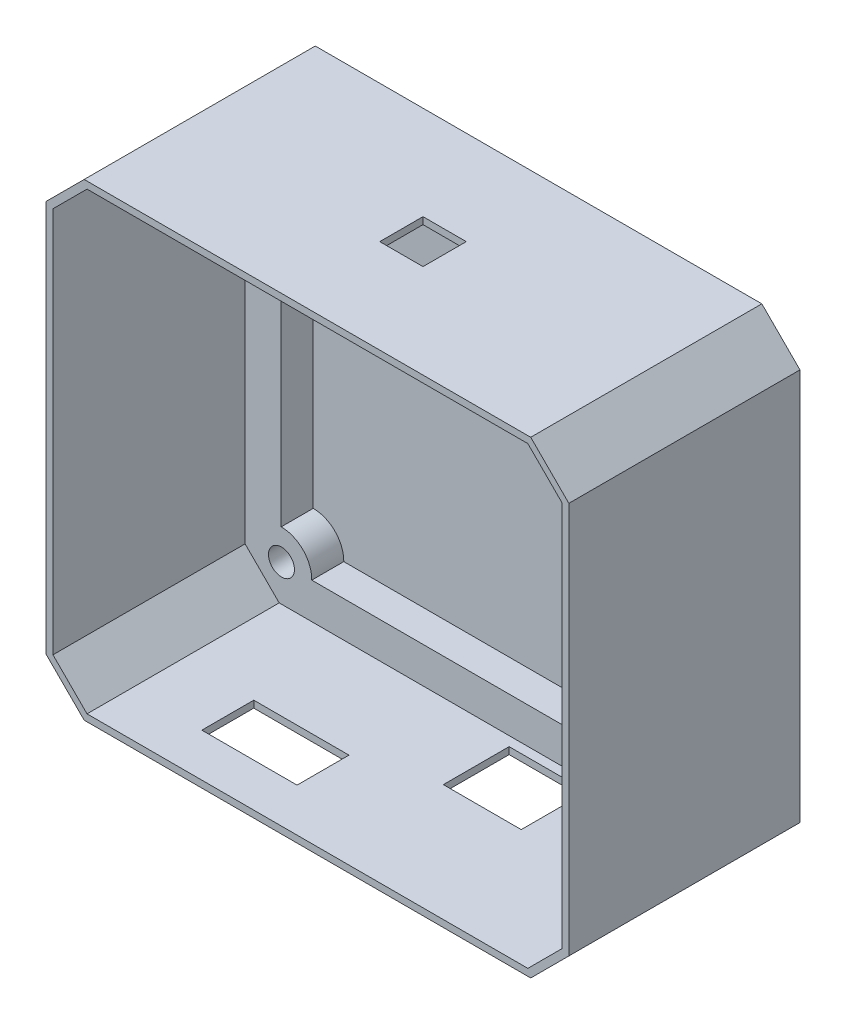
from build123d import *

# Parameters (mm, degrees)
EXTRUDE_1_DEPTH     = 22.2
EXTRUDE_2_DEPTH     = 4.5
SKETCH_3_R          = 1.5
CUT_EXTRUDE_1_DEPTH = 47.223181414
CUT_EXTRUDE_3_DEPTH = 3.7
CUT_EXTRUDE_4_REACH = 67.816
SKETCH_6_W          = 9
SKETCH_6_H          = 7.6
SKETCH_6_W_2        = 11
SKETCH_6_H_2        = 6
CUT_EXTRUDE_5_REACH = 67.816
SKETCH_7_W          = 5
SKETCH_7_H          = 5


with BuildPart() as part:
    # 草圖1 → 填料-伸長1 (new body)
    with BuildSketch(Plane.XY):
        Polygon((-25.794213562, 27.05), (25.794213562, 27.05), (30.2, 22.644213562), (30.2, -22.644213562), (25.794213562, -27.05), (-25.794213562, -27.05), (-30.2, -22.644213562), (-30.2, 22.644213562), align=None)
        Polygon((-29.4, 22.312842712), (-25.462842712, 26.25), (25.462842712, 26.25), (29.4, 22.312842712), (29.4, -22.312842712), (25.462842712, -26.25), (-25.462842712, -26.25), (-29.4, -22.312842712), align=None, mode=Mode.SUBTRACT)
    extrude(amount=EXTRUDE_1_DEPTH)

    # 草圖2 → 填料-伸長2 (add)
    with BuildSketch(Plane(origin=(0, 0, 0), x_dir=(-1, 0, 0), z_dir=(0, 0, -1))):
        Polygon((-30.2, 22.644213562), (-25.794213562, 27.05), (25.794213562, 27.05), (30.2, 22.644213562), (30.2, -22.644213562), (25.794213562, -27.05), (-25.794213562, -27.05), (-30.2, -22.644213562), align=None)
    extrude(amount=EXTRUDE_2_DEPTH)

    # 草圖3 → 除料-伸長1 (cut, through all)
    with BuildSketch(Plane.XY):
        with Locations((25.2, 22.03)):
            Circle(SKETCH_3_R)
        with Locations(Location((25.2, -22.03, 0), (0, 0, 180))):
            Circle(SKETCH_3_R)
        with Locations((-25.2, -22.03)):
            Circle(SKETCH_3_R)
        with Locations(Location((-25.2, 22.03, 0), (0, 0, 180))):
            Circle(SKETCH_3_R)
    extrude(amount=-CUT_EXTRUDE_1_DEPTH, mode=Mode.SUBTRACT)

    # 草圖5 → 除料-伸長3 (cut)
    with BuildSketch(Plane.XY):
        with BuildLine():
            Line((-25.234050993, 18.530165643), (-25.234050993, -18.530165643))
            ThreePointArc((-25.234050993, -18.530165643), (-22.715358839, -19.564932394), (-21.700544406, -22.091729589))
            Line((-21.700544406, -22.091729589), (21.700544406, -22.091729589))
            ThreePointArc((21.700544406, -22.091729589), (22.737758998, -19.542557689), (25.297360416, -18.531354412))
            Line((25.297360416, -18.531354412), (25.297360416, 18.531354412))
            ThreePointArc((25.297360416, 18.531354412), (22.56426249, 19.727200014), (21.74608079, 22.596076045))
            Line((21.74608079, 22.596076045), (-21.74608079, 22.596076045))
            ThreePointArc((-21.74608079, 22.596076045), (-22.543539666, 19.751136578), (-25.234050993, 18.530165643))
        make_face()
    extrude(amount=-CUT_EXTRUDE_3_DEPTH, mode=Mode.SUBTRACT)

    # 草圖6 → 除料-伸長4 (cut, up to next)
    with BuildSketch(Plane.XZ.offset(27.05), mode=Mode.PRIVATE) as cut_extrude_4_sk1:
        with Locations((6.7, 4.9)):
            Rectangle(SKETCH_6_W, SKETCH_6_H)
    cut_extrude_4_tool1 = extrude(cut_extrude_4_sk1.sketch, amount=-CUT_EXTRUDE_4_REACH, mode=Mode.PRIVATE) & part.part
    # 草圖6 → 除料-伸長4 (cut, up to next)
    with BuildSketch(Plane.XZ.offset(27.05), mode=Mode.PRIVATE) as cut_extrude_4_sk2:
        with Locations((-11.7, 14.2)):
            Rectangle(SKETCH_6_W_2, SKETCH_6_H_2)
    cut_extrude_4_tool2 = extrude(cut_extrude_4_sk2.sketch, amount=-CUT_EXTRUDE_4_REACH, mode=Mode.PRIVATE) & part.part
    add(cut_extrude_4_tool1.solids().sort_by_distance((6.7, -27.05, 4.9))[0], mode=Mode.SUBTRACT)
    add(cut_extrude_4_tool2.solids().sort_by_distance((-11.7, -27.05, 14.2))[0], mode=Mode.SUBTRACT)

    # 草圖7 → 除料-伸長5 (cut, up to next)
    with BuildSketch(Plane(origin=(0, 27.05, 0), x_dir=(1, 0, 0), z_dir=(0, 1, 0)), mode=Mode.PRIVATE) as cut_extrude_5_sk1:
        with Locations((0, -8.85)):
            Rectangle(SKETCH_7_W, SKETCH_7_H)
    cut_extrude_5_tool1 = extrude(cut_extrude_5_sk1.sketch, amount=-CUT_EXTRUDE_5_REACH, mode=Mode.PRIVATE) & part.part
    add(cut_extrude_5_tool1.solids().sort_by_distance((0, 27.05, 8.85))[0], mode=Mode.SUBTRACT)


solid = part.part
